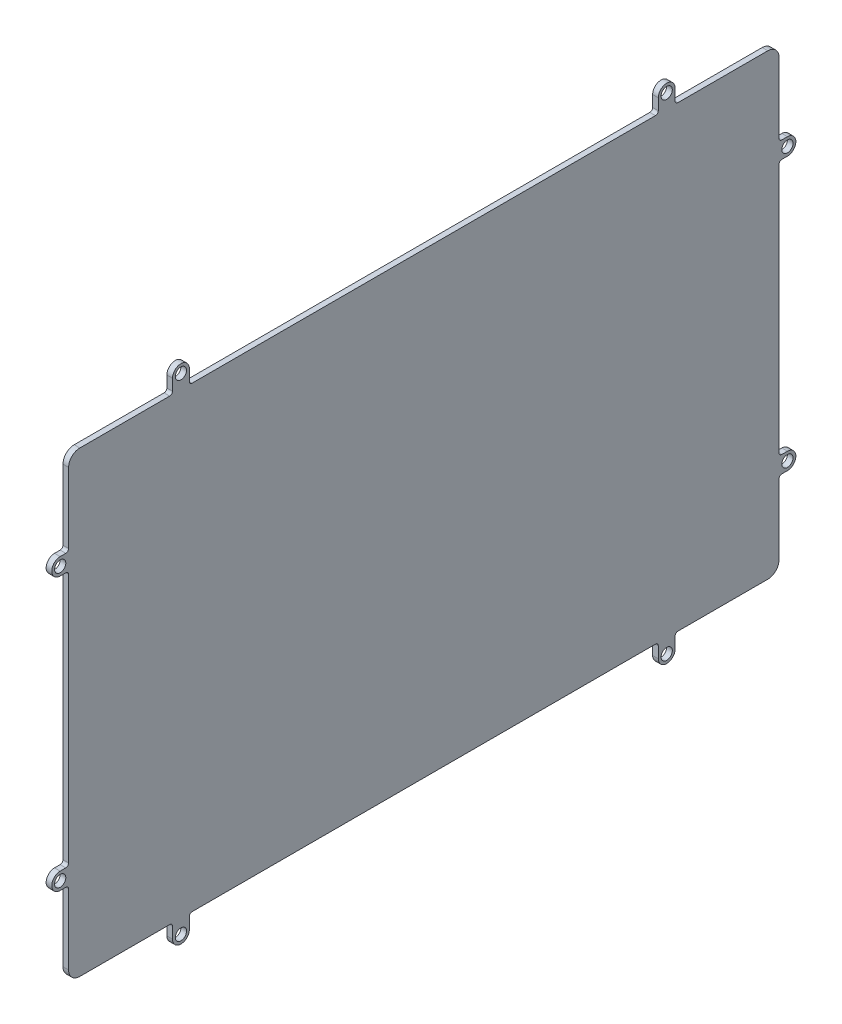
from build123d import *

# Parameters (mm, degrees)
Y_KSEKLIK_EKSTR_ZYON1_DEPTH = 2
IZIM2_R                     = 2
KES_EKSTR_ZYON1_DEPTH       = 2


with BuildPart() as part:
    # Çizim1 → Yükseklik-Ekstrüzyon1 (new body)
    with BuildSketch(Plane.YZ):
        with BuildLine():
            Line((78.698599078, 126.350175115), (53.698599078, 126.350175115))
            ThreePointArc((53.698599078, 126.350175115), (52.991492297, 126.643068334), (52.698599078, 127.350175115))
            Line((52.698599078, 127.350175115), (52.698599078, 129.350175115))
            ThreePointArc((52.698599078, 129.350175115), (49.698599078, 132.350175115), (46.698599078, 129.350175115))
            Line((46.698599078, 129.350175115), (46.698599078, 127.350175115))
            ThreePointArc((46.698599078, 127.350175115), (46.40570586, 126.643068334), (45.698599078, 126.350175115))
            Line((45.698599078, 126.350175115), (-43.301400922, 126.350175115))
            ThreePointArc((-43.301400922, 126.350175115), (-44.008507703, 126.643068334), (-44.301400922, 127.350175115))
            Line((-44.301400922, 127.350175115), (-44.301400922, 129.350175115))
            ThreePointArc((-44.301400922, 129.350175115), (-47.301400922, 132.350175115), (-50.301400922, 129.350175115))
            Line((-50.301400922, 129.350175115), (-50.301400922, 127.350175115))
            ThreePointArc((-50.301400922, 127.350175115), (-50.59429414, 126.643068334), (-51.301400922, 126.350175115))
            Line((-51.301400922, 126.350175115), (-76.301400922, 126.350175115))
            ThreePointArc((-76.301400922, 126.350175115), (-79.129828046, 125.17860224), (-80.301400922, 122.350175115))
            Line((-80.301400922, 122.350175115), (-80.301400922, 90.350175115))
            ThreePointArc((-80.301400922, 90.350175115), (-80.59429414, 89.643068334), (-81.301400922, 89.350175115))
            Line((-81.301400922, 89.350175115), (-85.301400922, 89.350175115))
            ThreePointArc((-85.301400922, 89.350175115), (-88.301400922, 86.350175115), (-85.301400922, 83.350175115))
            Line((-85.301400922, 83.350175115), (-81.301400922, 83.350175115))
            ThreePointArc((-81.301400922, 83.350175115), (-80.59429414, 83.057281896), (-80.301400922, 82.350175115))
            Line((-80.301400922, 82.350175115), (-80.301400922, -82.649824885))
            ThreePointArc((-80.301400922, -82.649824885), (-80.59429414, -83.356931666), (-81.301400922, -83.649824885))
            Line((-81.301400922, -83.649824885), (-85.301400922, -83.649824885))
            ThreePointArc((-85.301400922, -83.649824885), (-88.301400922, -86.649824885), (-85.301400922, -89.649824885))
            Line((-85.301400922, -89.649824885), (-81.301400922, -89.649824885))
            ThreePointArc((-81.301400922, -89.649824885), (-80.59429414, -89.942718104), (-80.301400922, -90.649824885))
            Line((-80.301400922, -90.649824885), (-80.301400922, -122.649824885))
            ThreePointArc((-80.301400922, -122.649824885), (-79.129828046, -125.47825201), (-76.301400922, -126.649824885))
            Line((-76.301400922, -126.649824885), (-51.301400922, -126.649824885))
            ThreePointArc((-51.301400922, -126.649824885), (-50.59429414, -126.942718104), (-50.301400922, -127.649824885))
            Line((-50.301400922, -127.649824885), (-50.301400922, -129.649824885))
            ThreePointArc((-50.301400922, -129.649824885), (-47.301400922, -132.649824885), (-44.301400922, -129.649824885))
            Line((-44.301400922, -129.649824885), (-44.301400922, -127.649824885))
            ThreePointArc((-44.301400922, -127.649824885), (-44.008507703, -126.942718104), (-43.301400922, -126.649824885))
            Line((-43.301400922, -126.649824885), (45.698599078, -126.649824885))
            ThreePointArc((45.698599078, -126.649824885), (46.40570586, -126.942718104), (46.698599078, -127.649824885))
            Line((46.698599078, -127.649824885), (46.698599078, -129.649824885))
            ThreePointArc((46.698599078, -129.649824885), (49.698599078, -132.649824885), (52.698599078, -129.649824885))
            Line((52.698599078, -129.649824885), (52.698599078, -127.649824885))
            ThreePointArc((52.698599078, -127.649824885), (52.991492297, -126.942718104), (53.698599078, -126.649824885))
            Line((53.698599078, -126.649824885), (78.698599078, -126.649824885))
            ThreePointArc((78.698599078, -126.649824885), (81.527026203, -125.47825201), (82.698599078, -122.649824885))
            Line((82.698599078, -122.649824885), (82.698599078, -90.649824885))
            ThreePointArc((82.698599078, -90.649824885), (82.991492297, -89.942718104), (83.698599078, -89.649824885))
            Line((83.698599078, -89.649824885), (87.698599078, -89.649824885))
            ThreePointArc((87.698599078, -89.649824885), (90.698599078, -86.649824885), (87.698599078, -83.649824885))
            Line((87.698599078, -83.649824885), (83.698599078, -83.649824885))
            ThreePointArc((83.698599078, -83.649824885), (82.991492297, -83.356931666), (82.698599078, -82.649824885))
            Line((82.698599078, -82.649824885), (82.698599078, 82.350175115))
            ThreePointArc((82.698599078, 82.350175115), (82.991492297, 83.057281896), (83.698599078, 83.350175115))
            Line((83.698599078, 83.350175115), (87.698599078, 83.350175115))
            ThreePointArc((87.698599078, 83.350175115), (90.698599078, 86.350175115), (87.698599078, 89.350175115))
            Line((87.698599078, 89.350175115), (83.698599078, 89.350175115))
            ThreePointArc((83.698599078, 89.350175115), (82.991492297, 89.643068334), (82.698599078, 90.350175115))
            Line((82.698599078, 90.350175115), (82.698599078, 122.350175115))
            ThreePointArc((82.698599078, 122.350175115), (81.527026203, 125.17860224), (78.698599078, 126.350175115))
        make_face()
    extrude(amount=Y_KSEKLIK_EKSTR_ZYON1_DEPTH)

    # Çizim2 → Kes-Ekstrüzyon1 (cut)
    with BuildSketch(Plane.YZ.offset(2)):
        with Locations(Location((-47.301400922, 129.350175115, 0), (0, 0, 270))):
            Circle(IZIM2_R)
    kes_ekstr_zyon1 = extrude(amount=-KES_EKSTR_ZYON1_DEPTH, mode=Mode.SUBTRACT)

    # Çizim-Çoğaltma1: Kes-Ekstrüzyon1 at 7 more places
    with Locations((0, 97, 0), (0, 135, -43), (0, -38, -43), (0, -38, -216), (0, 0, -259), (0, 97, -259), (0, 135, -216)):
        add(kes_ekstr_zyon1, mode=Mode.SUBTRACT)


solid = part.part
